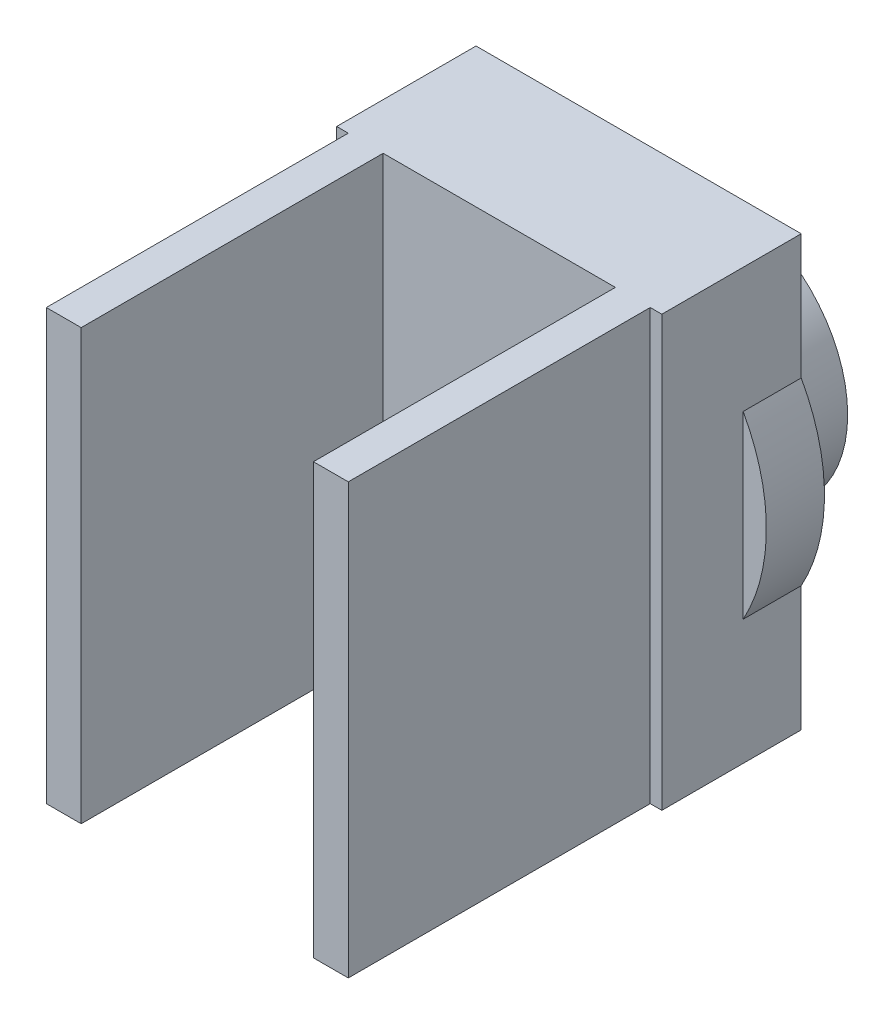
from build123d import *

# Parameters (mm, degrees)
SKETCH_1_R      = 22
EXTRUDE_1_DEPTH = 14
SKETCH_2_R      = 32
EXTRUDE_2_DEPTH = 10
SKETCH_3_W      = 56
SKETCH_3_H      = 74
EXTRUDE_3_DEPTH = 24
SKETCH_4_W      = 6
SKETCH_4_H      = 74
EXTRUDE_4_DEPTH = 76


with BuildPart() as part:
    # 草图1 → 凸台-拉伸1 (new body)
    with BuildSketch(Plane.XY):
        Circle(SKETCH_1_R)
    extrude(amount=-EXTRUDE_1_DEPTH)

    # 草图2 → 凸台-拉伸2 (add)
    with BuildSketch(Plane.XY):
        Circle(SKETCH_2_R)
    extrude(amount=EXTRUDE_2_DEPTH)

    # 草图3 → 凸台-拉伸3 (add)
    with BuildSketch(Plane.XY):
        Rectangle(SKETCH_3_W, SKETCH_3_H)
    extrude(amount=EXTRUDE_3_DEPTH)

    # 草图4 → 凸台-拉伸4 (add)
    with BuildSketch(Plane.XY):
        with Locations((23, 0)):
            Rectangle(SKETCH_4_W, SKETCH_4_H)
        with Locations((-23, 0)):
            Rectangle(SKETCH_4_W, SKETCH_4_H)
    extrude(amount=EXTRUDE_4_DEPTH)


solid = part.part
